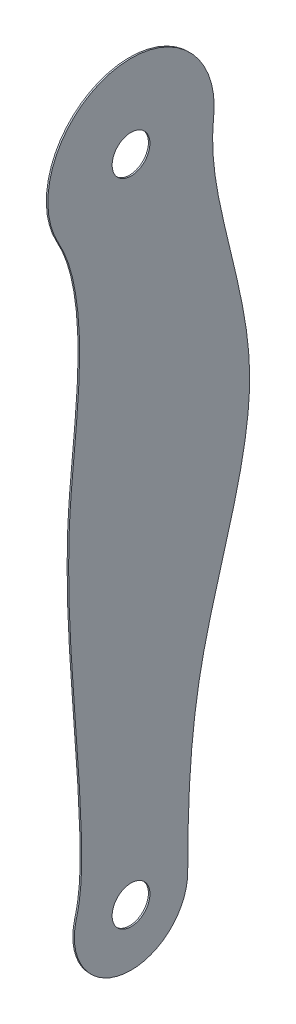
from build123d import *

# Parameters (mm, degrees)
SKETCH3_R      = 12.5
EXTRUDE1_DEPTH = 0.5


with BuildPart() as part:
    # Sketch3 → Extrude1 (new, symmetric)
    with BuildSketch(Plane(origin=(0, 0, 0), x_dir=(0, 0, -1), z_dir=(1, 0, 0))):
        with BuildLine():
            ThreePointArc((-36.207031651, 9.762215886), (-4.923734004, -37.175352634), (37.5, 0))
            add(Edge.make_bspline(
                [(54.652290082, 423.825278241), (52.509509177, 404.859584217), (61.688430189, 350.928455024), (93.740739008, 248.146468923), (40.812256209, 127.830390939), (37.5, 38.493002207), (37.5, 0)],
                knots=[0, 0, 0, 0, 0.133447201, 0.376558764, 0.731484898, 1, 1, 1, 1], degree=3))
            ThreePointArc((54.652290082, 423.825278241), (-10.84310867, 483.920561889), (-48.017058979, 403.179074456))
            add(Edge.make_bspline(
                [(-48.017058979, 403.179074456), (-41.112444302, 390.817857106), (-27.905320028, 336.914546659), (-50.20843212, 219.173527848), (-32.204632677, 102.502128563), (-32.423669788, 23.794306992), (-36.207031651, 9.762215886)],
                knots=[0, 0, 0, 0, 0.106358982, 0.411206468, 0.890017974, 1, 1, 1, 1], degree=3))
        make_face()
        with Locations((0, 430)):
            Circle(SKETCH3_R, mode=Mode.SUBTRACT)
        Circle(SKETCH3_R, mode=Mode.SUBTRACT)
    extrude(amount=EXTRUDE1_DEPTH, both=True)


solid = part.part
